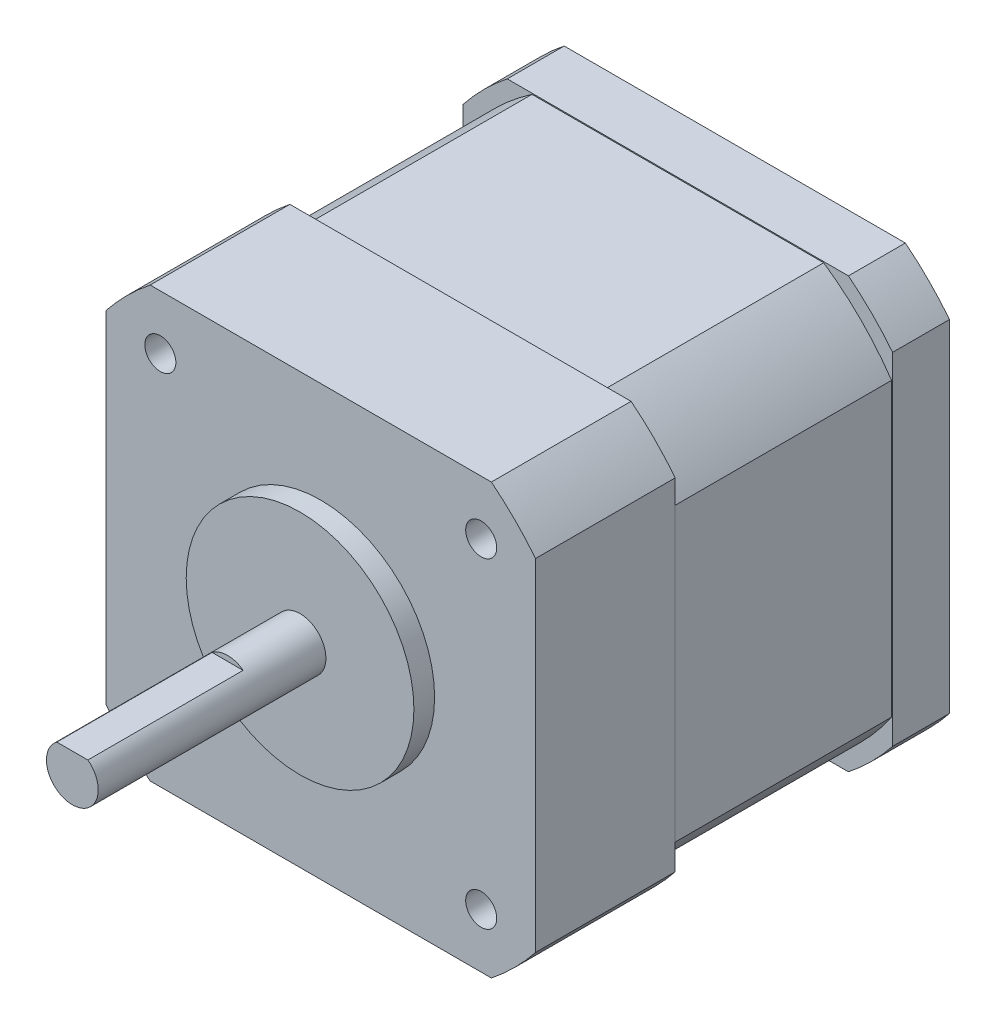
from build123d import *

# Parameters (mm, degrees)
SKETCH1_R                       = 2.5
BOSS_EXTRUDE1_DEPTH             = 24
SKETCH2_R                       = 11
BOSS_EXTRUDE2_DEPTH             = 2
SKETCH3_W                       = 41.5
SKETCH3_H                       = 41.5
BOSS_EXTRUDE3_DEPTH             = 40
CUT_EXTRUDE1_DEPTH              = 71.40685336
CUT_EXTRUDE1_DEPTH_BACK         = 71.40685336
M3X0_5_TAPPED_HOLE1_D           = 2.5
M3X0_5_TAPPED_HOLE1_DEPTH       = 7.5
M3X0_5_TAPPED_HOLE1_CBORE_D     = 3
M3X0_5_TAPPED_HOLE1_CBORE_DEPTH = 6
M3X0_5_TAPPED_HOLE1_TIP         = 0.751075774
CUT_EXTRUDE2_START              = -15
CUT_EXTRUDE2_DEPTH              = 15
CUT_EXTRUDE3_DEPTH              = 10.5


with BuildPart() as part:
    # Sketch1 → Boss-Extrude1 (new body)
    with BuildSketch(Plane.XY):
        Circle(SKETCH1_R)
    extrude(amount=BOSS_EXTRUDE1_DEPTH)

    # Sketch2 → Boss-Extrude2 (add)
    with BuildSketch(Plane(origin=(0, 0, 0), x_dir=(-1, 0, 0), z_dir=(0, 0, -1))):
        Circle(SKETCH2_R)
    extrude(amount=-BOSS_EXTRUDE2_DEPTH)

    # Sketch3 → Boss-Extrude3 (add)
    with BuildSketch(Plane(origin=(0, 0, 0), x_dir=(-1, 0, 0), z_dir=(0, 0, -1))):
        Rectangle(SKETCH3_W, SKETCH3_H)
    extrude(amount=BOSS_EXTRUDE3_DEPTH)

    # Sketch4 → Cut-Extrude1 (cut, two sides: drawn at the far end of the back side and taken through both)
    with BuildSketch(Plane(origin=(0, 0, -40), x_dir=(-1, 0, 0), z_dir=(0, 0, -1)).offset(-CUT_EXTRUDE1_DEPTH_BACK)):
        with BuildLine():
            Line((-20.75, -16.482945732), (-20.75, -20.75))
            Line((-20.75, -20.75), (-16.482945732, -20.75))
            ThreePointArc((-16.482945732, -20.75), (-18.738329701, -18.738329701), (-20.75, -16.482945732))
        make_face()
        with BuildLine():
            Line((16.482945732, -20.75), (20.75, -20.75))
            Line((20.75, -20.75), (20.75, -16.482945732))
            ThreePointArc((20.75, -16.482945732), (18.738329701, -18.738329701), (16.482945732, -20.75))
        make_face()
        with BuildLine():
            Line((20.75, 16.482945732), (20.75, 20.75))
            Line((20.75, 20.75), (16.482945732, 20.75))
            ThreePointArc((16.482945732, 20.75), (18.738329701, 18.738329701), (20.75, 16.482945732))
        make_face()
        with BuildLine():
            Line((-16.482945732, 20.75), (-20.75, 20.75))
            Line((-20.75, 20.75), (-20.75, 16.482945732))
            ThreePointArc((-20.75, 16.482945732), (-18.738329701, 18.738329701), (-16.482945732, 20.75))
        make_face()
    extrude(amount=CUT_EXTRUDE1_DEPTH + CUT_EXTRUDE1_DEPTH_BACK, mode=Mode.SUBTRACT)

    # M3x0.5 Tapped Hole1
    with Locations(Plane.XY):
        with Locations((-15.5, 15.5), (-15.5, -15.5), (15.5, -15.5), (15.5, 15.5)):
            CounterBoreHole(M3X0_5_TAPPED_HOLE1_D / 2, M3X0_5_TAPPED_HOLE1_CBORE_D / 2, M3X0_5_TAPPED_HOLE1_CBORE_DEPTH, depth=M3X0_5_TAPPED_HOLE1_DEPTH)
            with Locations((0, 0, -(M3X0_5_TAPPED_HOLE1_DEPTH + M3X0_5_TAPPED_HOLE1_TIP / 2))):  # 118° drill point
                Cone(0, M3X0_5_TAPPED_HOLE1_D / 2, M3X0_5_TAPPED_HOLE1_TIP, mode=Mode.SUBTRACT)

    # Sketch7 → Cut-Extrude2 (cut)
    with BuildSketch(Plane.XY.offset(24).offset(CUT_EXTRUDE2_START)):
        with BuildLine():
            Line((-1.5, 2), (1.5, 2))
            ThreePointArc((1.5, 2), (0, 2.5), (-1.5, 2))
        make_face()
    extrude(amount=CUT_EXTRUDE2_DEPTH, mode=Mode.SUBTRACT)

    # Sketch8 → Cut-Extrude3 (cut, symmetric)
    with BuildSketch(Plane.XY.offset(-24)):
        with BuildLine():
            Line((16.482945732, 20.75), (-16.482945732, 20.75))
            ThreePointArc((-16.482945732, 20.75), (-18.738329701, 18.738329701), (-20.75, 16.482945732))
            Line((-20.75, 16.482945732), (-20.75, -16.482945732))
            ThreePointArc((-20.75, -16.482945732), (-18.738329701, -18.738329701), (-16.482945732, -20.75))
            Line((-16.482945732, -20.75), (16.482945732, -20.75))
            ThreePointArc((16.482945732, -20.75), (18.738329701, -18.738329701), (20.75, -16.482945732))
            Line((20.75, -16.482945732), (20.75, 16.482945732))
            ThreePointArc((20.75, 16.482945732), (18.738329701, 18.738329701), (16.482945732, 20.75))
        make_face()
        with BuildLine():
            Line((-14.091752907, 20.65), (14.091752907, 20.65))
            ThreePointArc((14.091752907, 20.65), (17.67766953, 17.67766953), (20.65, 14.091752907))
            Line((20.65, 14.091752907), (20.65, -14.091752907))
            ThreePointArc((20.65, -14.091752907), (17.67766953, -17.67766953), (14.091752907, -20.65))
            Line((14.091752907, -20.65), (-14.091752907, -20.65))
            ThreePointArc((-14.091752907, -20.65), (-17.67766953, -17.67766953), (-20.65, -14.091752907))
            Line((-20.65, -14.091752907), (-20.65, 14.091752907))
            ThreePointArc((-20.65, 14.091752907), (-17.67766953, 17.67766953), (-14.091752907, 20.65))
        make_face(mode=Mode.SUBTRACT)
    extrude(amount=CUT_EXTRUDE3_DEPTH, both=True, mode=Mode.SUBTRACT)


solid = part.part
